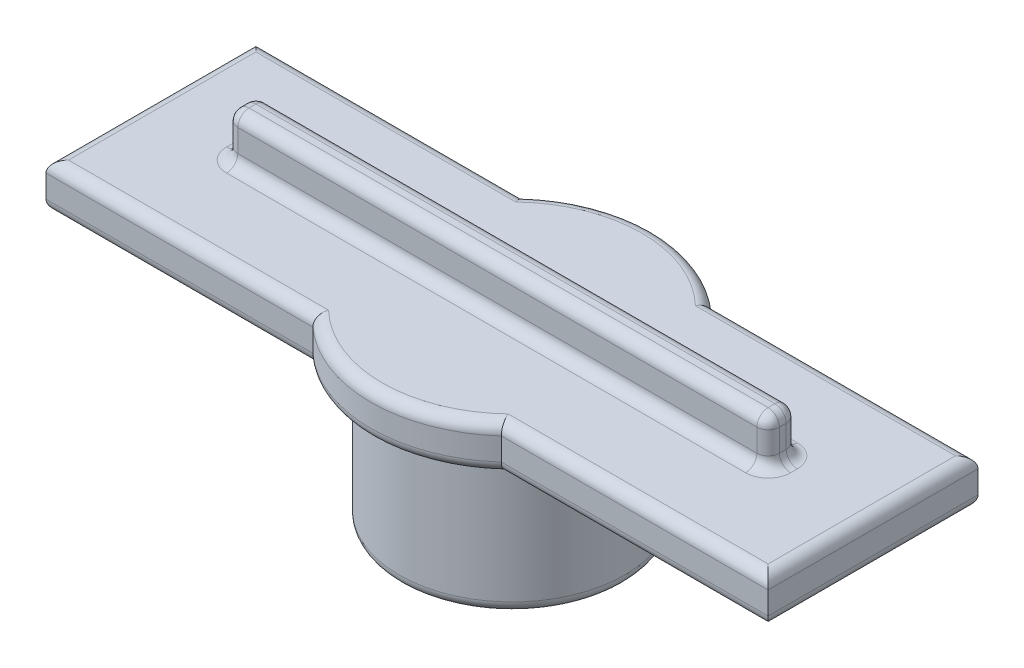
from build123d import *

# Parameters (mm, degrees)
SKETCH1_R           = 12.7
BOSS_EXTRUDE1_DEPTH = 15.875
SKETCH2_R           = 15.875
BOSS_EXTRUDE2_DEPTH = 5.08
SKETCH3_W           = 60.96
SKETCH3_H           = 3.302
BOSS_EXTRUDE3_DEPTH = 5.08
SKETCH4_W           = 81.28
SKETCH4_H           = 23.622
BOSS_EXTRUDE4_DEPTH = 5.08
FILLET1_R           = 1.27
FILLET2_R           = 1.27
FILLET3_R           = 1.27
FILLET4_R           = 1.27
FILLET5_R           = 1.27
FILLET7_R           = 1.27
FILLET8_R           = 1.27
SKETCH6_R           = 7.8105
CUT_EXTRUDE1_DEPTH  = 3.175
SKETCH7_R           = 7.8105
CUT_EXTRUDE2_DEPTH  = 10.795
CUT_EXTRUDE2_TAPER  = 35.8


with BuildPart() as part:
    # Sketch1 → Boss-Extrude1 (new body)
    with BuildSketch(Plane(origin=(0, 0, 0), x_dir=(1, 0, 0), z_dir=(0, 1, 0))):
        with Locations(Location((0, 0, 0), (0, 0, 270))):
            Circle(SKETCH1_R)
    extrude(amount=BOSS_EXTRUDE1_DEPTH)

    # Sketch2 → Boss-Extrude2 (add)
    with BuildSketch(Plane(origin=(0, 15.875, 0), x_dir=(1, 0, 0), z_dir=(0, 1, 0))):
        with Locations(Location((0, 0, 0), (0, 0, 270))):
            Circle(SKETCH2_R)
    extrude(amount=BOSS_EXTRUDE2_DEPTH)

    # Sketch3 → Boss-Extrude3 (add)
    with BuildSketch(Plane(origin=(0, 20.955, 0), x_dir=(1, 0, 0), z_dir=(0, 1, 0))):
        Rectangle(SKETCH3_W, SKETCH3_H)
    extrude(amount=BOSS_EXTRUDE3_DEPTH)

    # Sketch4 → Boss-Extrude4 (add)
    with BuildSketch(Plane.XZ.offset(-20.955)):
        Rectangle(SKETCH4_W, SKETCH4_H)
    extrude(amount=BOSS_EXTRUDE4_DEPTH)

    # Fillet1
    fillet1_edges = [part.edges().sort_by_distance(p)[0] for p in [
        (30.48, 23.495, 1.651),
        (30.48, 23.495, -1.651),
        (-30.48, 23.495, -1.651),
        (-30.48, 23.495, 1.651),
    ]]
    fillet(fillet1_edges, radius=FILLET1_R)

    # Fillet2
    fillet2_edges = [part.edges().sort_by_distance(p)[0] for p in [
        (0, 26.035, 1.651),
        (-30.48, 26.035, 0),
        (30.48, 26.035, 0),
        (0, 26.035, -1.651),
        (30.108025612, 26.035, 1.279025612),
        (30.108025612, 26.035, -1.279025612),
        (-30.108025612, 26.035, -1.279025612),
        (-30.108025612, 26.035, 1.279025612),
    ]]
    fillet(fillet2_edges, radius=FILLET2_R)

    # Fillet3
    fillet3_edges = [part.edges().sort_by_distance(p)[0] for p in [
        (0, 20.955, -15.875),
        (0, 20.955, 15.875),
        (25.623675707, 20.955, 11.811),
        (-25.623675707, 20.955, 11.811),
        (-25.623675707, 20.955, -11.811),
        (25.623675707, 20.955, -11.811),
        (40.64, 20.955, 0),
        (-40.64, 20.955, 0),
    ]]
    fillet(fillet3_edges, radius=FILLET3_R)

    # Fillet4
    fillet4_edges = [part.edges().sort_by_distance(p)[0] for p in [
        (0, 15.875, -15.875),
        (0, 15.875, 15.875),
        (25.623675707, 15.875, -11.811),
        (40.64, 15.875, 0),
        (25.623675707, 15.875, 11.811),
        (-25.623675707, 15.875, 11.811),
        (-40.64, 15.875, 0),
        (-25.623675707, 15.875, -11.811),
    ]]
    fillet(fillet4_edges, radius=FILLET4_R)

    # Fillet5
    fillet5_edges = [part.edges().sort_by_distance(p)[0] for p in [
        (0, 15.875, -12.7),
    ]]
    fillet(fillet5_edges, radius=FILLET5_R)

    # Fillet7
    fillet7_edges = [part.edges().sort_by_distance(p)[0] for p in [
        (0, 0, -12.7),
    ]]
    fillet(fillet7_edges, radius=FILLET7_R)

    # Fillet8
    fillet8_edges = [part.edges().sort_by_distance(p)[0] for p in [
        (0, 20.955, 1.651),
        (-30.48, 20.955, 0),
        (0, 20.955, -1.651),
        (30.48, 20.955, 0),
        (-30.108025612, 20.955, 1.279025612),
        (-30.108025612, 20.955, -1.279025612),
        (30.108025612, 20.955, -1.279025612),
        (30.108025612, 20.955, 1.279025612),
    ]]
    fillet(fillet8_edges, radius=FILLET8_R)

    # Sketch6 → Cut-Extrude1 (cut)
    with BuildSketch(Plane.XZ):
        with Locations(Location((0, 0, 0), (0, 0, 270))):
            Circle(SKETCH6_R)
    extrude(amount=-CUT_EXTRUDE1_DEPTH, mode=Mode.SUBTRACT)

    # Sketch7 → Cut-Extrude2 (cut)
    with BuildSketch(Plane.XZ.offset(-3.175)):
        with Locations(Location((0, 0, 0), (0, 0, 270))):
            Circle(SKETCH7_R)
    extrude(amount=-CUT_EXTRUDE2_DEPTH, taper=CUT_EXTRUDE2_TAPER, mode=Mode.SUBTRACT)


solid = part.part
